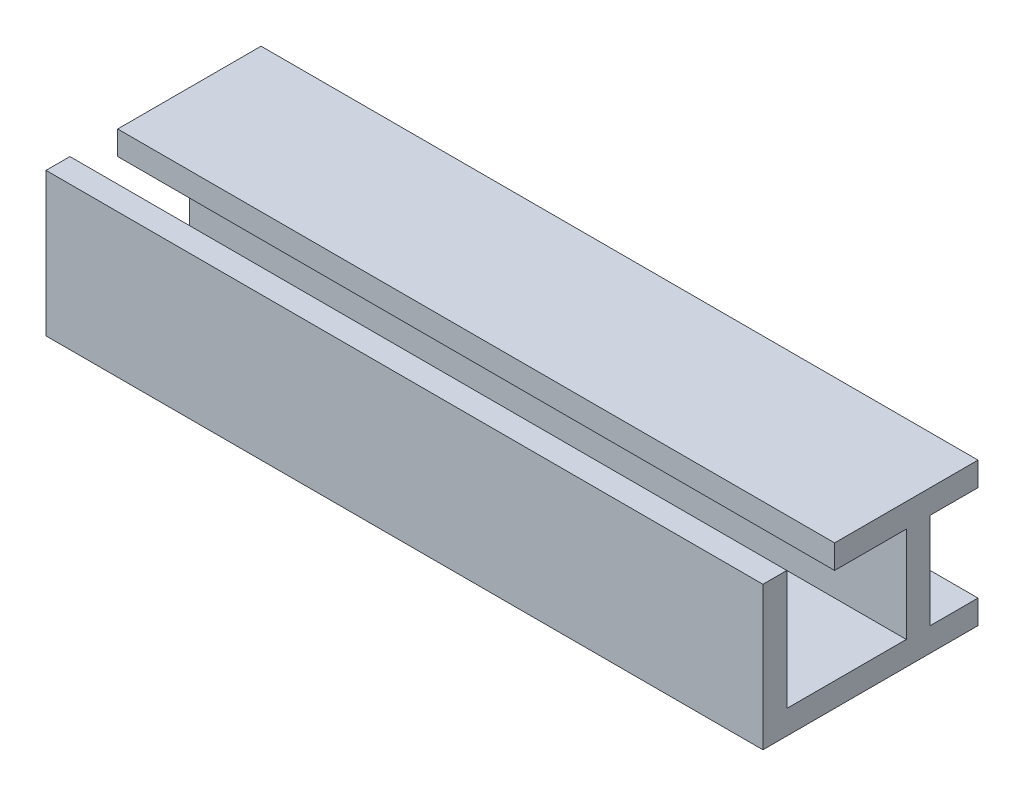
from build123d import *

# Parameters (mm, degrees)
EXTRUDE_1_DEPTH = 150


with BuildPart() as part:
    # Эскиз1 → Бобышка-Вытянуть1 (new body)
    with BuildSketch(Plane(origin=(0, 0, 0), x_dir=(0, 0, -1), z_dir=(1, 0, 0))):
        Polygon((0, 0), (45, 0), (45, 5), (35, 5), (35, 25), (45, 25), (45, 30), (15, 30), (15, 25), (30, 25), (30, 5), (5, 5), (5, 30), (0, 30), align=None)
    extrude(amount=EXTRUDE_1_DEPTH)


solid = part.part
